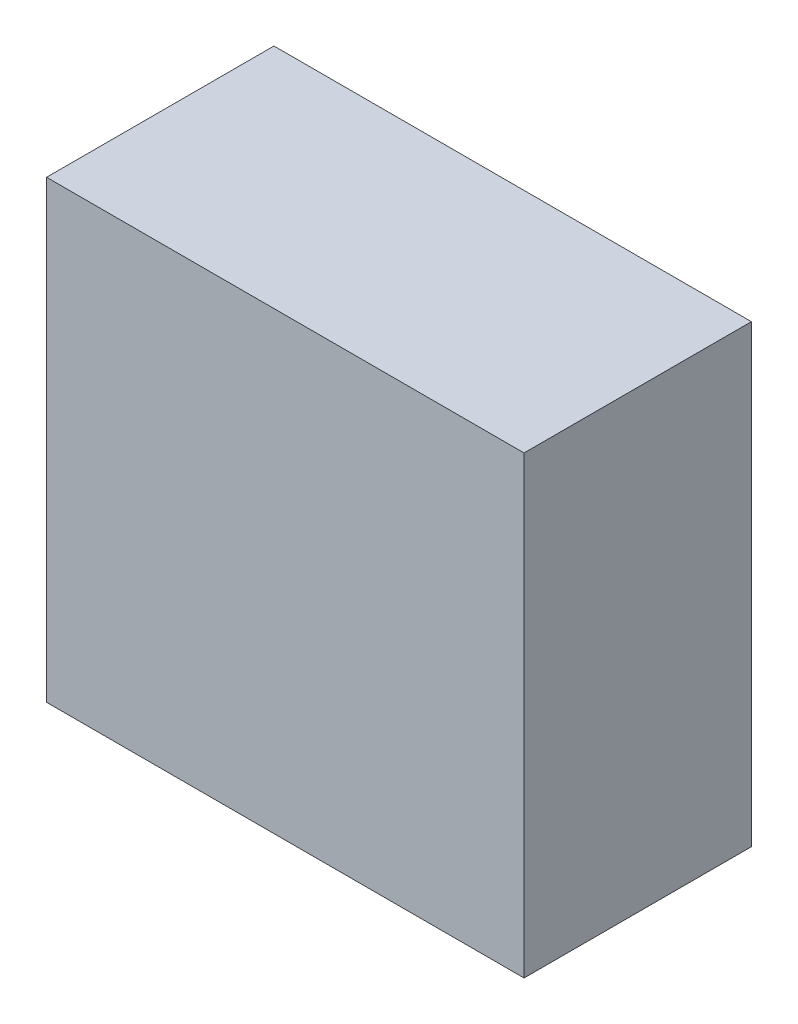
from build123d import *

# Parameters (mm, degrees)
SKETCH1_W           = 21
SKETCH1_H           = 20
BOSS_EXTRUDE1_DEPTH = 10


with BuildPart() as part:
    # Sketch1 → Boss-Extrude1 (new body)
    with BuildSketch(Plane.XY):
        with Locations((10.5, 10)):
            Rectangle(SKETCH1_W, SKETCH1_H)
    extrude(amount=BOSS_EXTRUDE1_DEPTH)


solid = part.part
